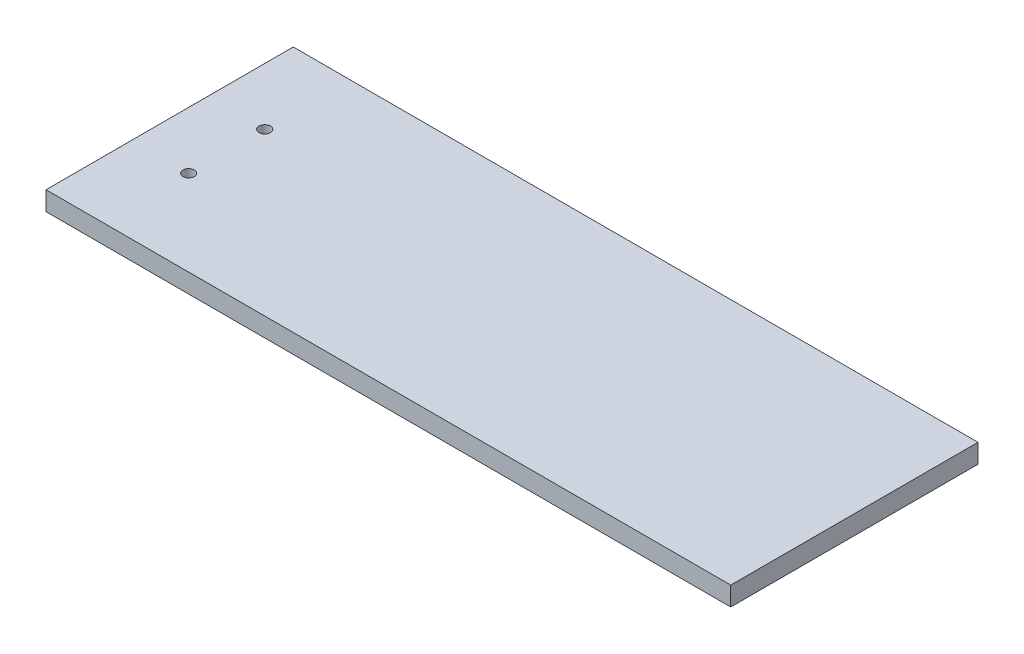
from build123d import *

# Parameters (mm, degrees)
SKETCH1_W           = 180
SKETCH1_H           = 65
BOSS_EXTRUDE1_DEPTH = 5
SKETCH2_R           = 1.5
CUT_EXTRUDE1_DEPTH  = 110.114800387


with BuildPart() as part:
    # Sketch1 → Boss-Extrude1 (new body)
    with BuildSketch(Plane(origin=(0, 0, 0), x_dir=(1, 0, 0), z_dir=(0, 1, 0))):
        with Locations((12.980769231, -3.221153846)):
            Rectangle(SKETCH1_W, SKETCH1_H)
    extrude(amount=BOSS_EXTRUDE1_DEPTH)

    # Sketch2 → Cut-Extrude1 (cut, through all)
    with BuildSketch(Plane(origin=(0, 5, 0), x_dir=(1, 0, 0), z_dir=(0, 1, 0))):
        with Locations(Location((-62.019230769, 6.778846154, 0), (0, 0, 270))):
            Circle(SKETCH2_R)
        with Locations(Location((-62.019230769, -13.221153846, 0), (0, 0, 270))):
            Circle(SKETCH2_R)
    extrude(amount=-CUT_EXTRUDE1_DEPTH, mode=Mode.SUBTRACT)


solid = part.part
